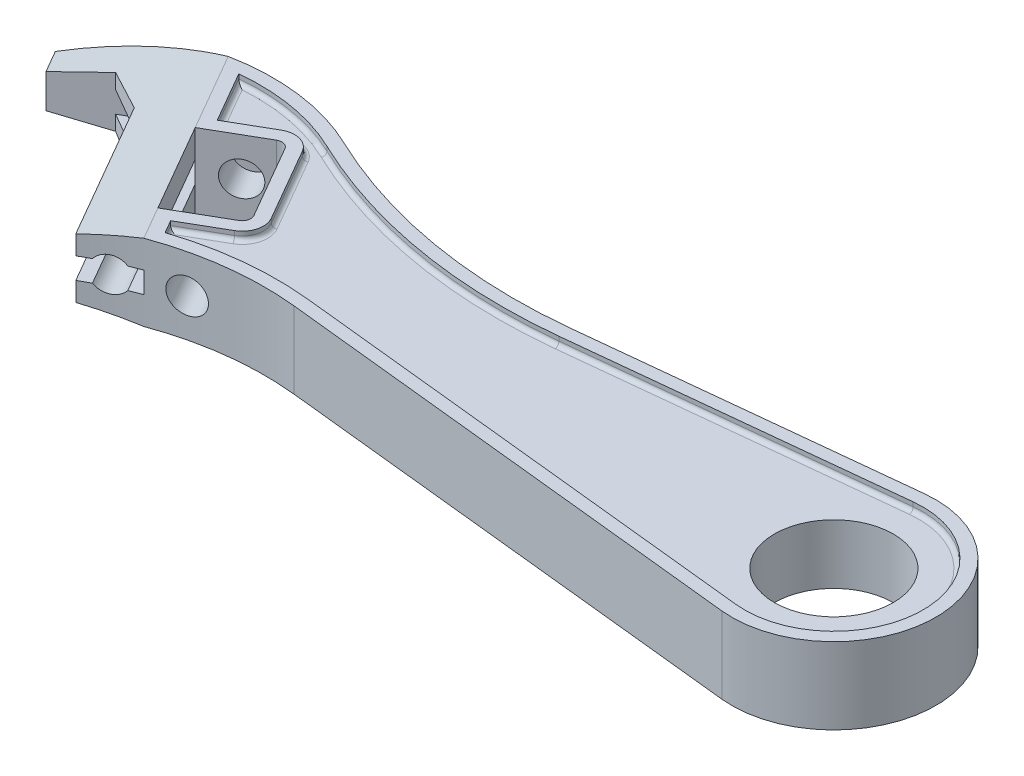
from build123d import *

# Parameters (mm, degrees)
SKETCH1_R               = 7
BOSS_EXTRUDE1_DEPTH     = 4.5
CUT_EXTRUDE1_DEPTH      = 93.949210636
CUT_EXTRUDE1_DEPTH_BACK = 4
SKETCH2_R               = 2
CUT_EXTRUDE2_DEPTH      = 94.860420286
CUT_EXTRUDE3_DEPTH      = 94.860420286
CUT_EXTRUDE3_DEPTH_BACK = 94.860420286
FILLET1_R               = 1
CUT_EXTRUDE4_START      = -1
CUT_EXTRUDE4_DEPTH      = 103.671038166
FILLET2_R               = 0.5
FILLET2_OF_MIRROR1_R    = 0.5


with BuildPart() as part:
    # Sketch1 → Boss-Extrude1 (new, symmetric)
    with BuildSketch(Plane(origin=(0, 0, 0), x_dir=(1, 0, 0), z_dir=(0, 1, 0))):
        with BuildLine():
            Line((-1.254341559, 11.934262744), (-38.985522111, 7.968555867))
            ThreePointArc((-38.985522111, 7.968555867), (-55.482588048, 8.517606008), (-71.205780018, 13.541138114))
            ThreePointArc((-71.205780018, 13.541138114), (-86.438642867, 15.605996242), (-100, 8.367671688))
            Line((-100, 8.367671688), (-98.5, 5.769595477))
            Line((-98.5, 5.769595477), (-93.303847577, 8.769595477))
            Line((-93.303847577, 8.769595477), (-88.107695155, 5.769595477))
            Line((-88.107695155, 5.769595477), (-78.705771366, -10.515014214))
            ThreePointArc((-78.705771366, -10.515014214), (-68.482680545, -6.590737321), (-57.547275152, -6.017637008))
            Line((-57.547275152, -6.017637008), (-1.254341559, -11.934262744))
            ThreePointArc((-1.254341559, -11.934262744), (12, 0), (-1.254341559, 11.934262744))
        make_face()
        with Locations(Location((0, 0, 0), (0, 0, 270))):
            Circle(SKETCH1_R, mode=Mode.SUBTRACT)
        Polygon((-81.509618943, 6.341392247), (-75.509618943, -4.050912599), (-68.581415713, -0.050912599), (-74.581415713, 10.341392247), align=None, mode=Mode.SUBTRACT)
    extrude(amount=BOSS_EXTRUDE1_DEPTH, both=True)

    # Sketch2 → Cut-Extrude1 (cut, two sides: drawn at the far end of the back side and taken through both)
    with BuildSketch(Plane(origin=(-23.123308126, 0, -40.050744514), x_dir=(0.86602540378444, 0, -0.49999999999999784), z_dir=(0.49999999999999784, 0, 0.86602540378444)).offset(-CUT_EXTRUDE1_DEPTH_BACK)):
        with Locations(Location((-63.418704534, 0, 0), (0, 0, 180))):
            Circle(SKETCH2_R)
    extrude(amount=CUT_EXTRUDE1_DEPTH + CUT_EXTRUDE1_DEPTH_BACK, mode=Mode.SUBTRACT)

    # Sketch3 → Cut-Extrude2 (cut, through all)
    with BuildSketch(Plane(origin=(-27.123308126, 0, -46.978947744), x_dir=(0.8660254037844406, 0, -0.4999999999999967), z_dir=(0.4999999999999967, 0, 0.8660254037844406))):
        with BuildLine():
            Line((-82.418704534, -1.25), (-71.979954034, -1.25))
            ThreePointArc((-71.979954034, -1.25), (-70.418704534, -2), (-68.857455035, -1.25))
            Line((-68.857455035, -1.25), (-67.418704534, -1.25))
            Line((-67.418704534, -1.25), (-67.418704534, 1.25))
            Line((-67.418704534, 1.25), (-68.857455035, 1.25))
            ThreePointArc((-68.857455035, 1.25), (-70.418704534, 2), (-71.979954034, 1.25))
            Line((-71.979954034, 1.25), (-82.418704534, 1.25))
            Line((-82.418704534, 1.25), (-82.418704534, -1.25))
        make_face()
    extrude(amount=CUT_EXTRUDE2_DEPTH, mode=Mode.SUBTRACT)

    # Sketch4 → Cut-Extrude3 (cut, two sides: drawn at the far end of the back side and taken through both)
    with BuildSketch(Plane(origin=(-27.123308126, 0, -46.978947744), x_dir=(0.8660254037844406, 0, -0.4999999999999967), z_dir=(0.4999999999999967, 0, 0.8660254037844406)).offset(-CUT_EXTRUDE3_DEPTH_BACK)):
        Polygon((-82.418704534, 4.5), (-82.418704534, 2), (-67.418704534, 4.5), align=None)
        Polygon((-82.418704534, -4.5), (-82.418704534, -2), (-67.418704534, -4.5), align=None)
    extrude(amount=CUT_EXTRUDE3_DEPTH + CUT_EXTRUDE3_DEPTH_BACK, mode=Mode.SUBTRACT)

    # Fillet1
    fillet1_edges = [part.edges().sort_by_distance(p)[0] for p in [
        (-74.581415713, 0, -10.341392247),
        (-68.581415713, 0, 0.050912599),
    ]]
    fillet(fillet1_edges, radius=FILLET1_R)

    # Sketch5 → Cut-Extrude4 (cut)
    with BuildSketch(Plane(origin=(0, 4.5, 0), x_dir=(1, 0, 0), z_dir=(0, 1, 0)).offset(CUT_EXTRUDE4_START)):
        with BuildLine():
            Line((-84.417038698, 14.377190981), (-80.960580838, 8.390430352))
            Line((-80.960580838, 8.390430352), (-76.197441117, 11.140430352))
            ThreePointArc((-76.197441117, 11.140430352), (-74.300393504, 11.390181409), (-72.782377607, 10.225366843))
            Line((-72.782377607, 10.225366843), (-67.782377607, 1.565112805))
            ThreePointArc((-67.782377607, 1.565112805), (-67.532626551, -0.331934808), (-68.697441117, -1.849950704))
            Line((-68.697441117, -1.849950704), (-73.460580838, -4.599950704))
            Line((-73.460580838, -4.599950704), (-72.571151937, -6.14048675))
            ThreePointArc((-72.571151937, -6.14048675), (-65.066176866, -4.530624461), (-57.390482457, -4.525854165))
            Line((-57.390482457, -4.525854165), (-1.097548864, -10.442479901))
            ThreePointArc((-1.097548864, -10.442479901), (10.5, 0), (-1.097548864, 10.442479901))
            Line((-1.097548864, 10.442479901), (-38.828729416, 6.476773024))
            ThreePointArc((-38.828729416, 6.476773024), (-55.738222001, 7.039549419), (-71.854493771, 12.188669828))
            ThreePointArc((-71.854493771, 12.188669828), (-77.984484997, 14.151314674), (-84.417038698, 14.377190981))
        make_face()
    cut_extrude4 = extrude(amount=CUT_EXTRUDE4_DEPTH, mode=Mode.SUBTRACT)

    # Fillet2
    fillet2_edges = [part.edges().sort_by_distance(p)[0] for p in [
        (-78.579010977, 3.5, -9.765430352),
        (-74.300393504, 3.5, -11.390181409),
        (-71.079010977, 3.5, 3.224950704),
        (-67.532626551, 3.5, 0.331934808),
        (-65.066176866, 3.5, 4.530624461),
        (-29.24401566, 3.5, 7.484167033),
        (10.5, 3.5, 0),
        (-19.96313914, 3.5, -8.459626463),
        (-55.738222001, 3.5, -7.039549419),
        (-73.015866387, 3.5, 5.370218727),
        (-70.282377607, 3.5, -5.895239824),
        (-82.688809768, 3.5, -11.383810667),
        (-77.984484997, 3.5, -14.151314674),
    ]]
    fillet(fillet2_edges, radius=FILLET2_R)

    # Mirror1: Cut-Extrude4 across plane
    add(cut_extrude4.mirror(Plane.ZX), mode=Mode.SUBTRACT)

    # Fillet2 of Mirror1
    fillet2_of_mirror1_edges = [part.edges().sort_by_distance(p)[0] for p in [
        (-78.579010977, -3.5, -9.765430352),
        (-74.300393504, -3.5, -11.390181409),
        (-71.079010977, -3.5, 3.224950704),
        (-67.532626551, -3.5, 0.331934808),
        (-65.066176866, -3.5, 4.530624461),
        (-29.24401566, -3.5, 7.484167033),
        (10.5, -3.5, 0),
        (-19.96313914, -3.5, -8.459626463),
        (-55.738222001, -3.5, -7.039549419),
        (-73.015866387, -3.5, 5.370218727),
        (-70.282377607, -3.5, -5.895239824),
        (-82.688809768, -3.5, -11.383810667),
        (-77.984484997, -3.5, -14.151314674),
    ]]
    fillet(fillet2_of_mirror1_edges, radius=FILLET2_OF_MIRROR1_R)


solid = part.part
